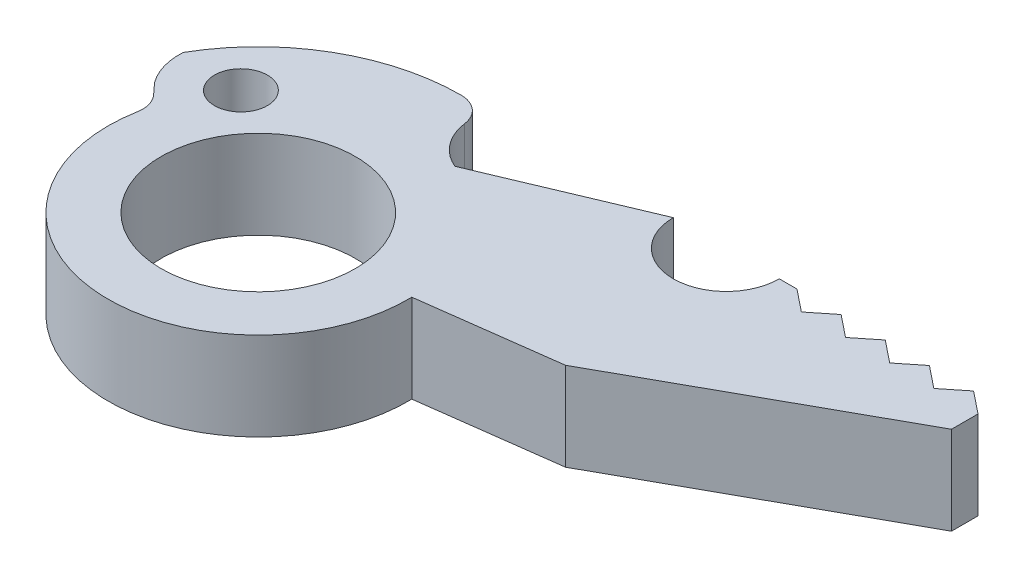
from build123d import *

# Parameters (mm, degrees)
SKETCH_1_R          = 5.5
SKETCH_1_R_2        = 1.5
EXTRUDE_2_DEPTH     = 5
CUT_EXTRUDE_1_DEPTH = 33.746182984


with BuildPart() as part:
    # Эскиз1 → Бобышка-Вытянуть2 (new body)
    with BuildSketch(Plane(origin=(0, 0, 0), x_dir=(1, 0, 0), z_dir=(0, 1, 0))):
        with BuildLine():
            ThreePointArc((-8.362025498, 1.525296552), (-0.667373394, -8.473760249), (8.497706046, 0.197463815))
            Line((8.497706046, 0.197463815), (16.18697839, 1.21124957))
            Line((16.18697839, 1.21124957), (30.25, 9))
            Line((30.25, 9), (30.25, 10.5))
            Line((30.25, 10.5), (29, 11.5))
            Line((29, 11.5), (27.75, 10.5))
            Line((27.75, 10.5), (26.5, 11.5))
            Line((26.5, 11.5), (25.25, 10.5))
            Line((25.25, 10.5), (24, 11.5))
            Line((24, 11.5), (22.75, 10.5))
            Line((22.75, 10.5), (21.5, 11.5))
            Line((21.5, 11.5), (20.25, 10.5))
            Line((20.25, 10.5), (19, 11.5))
            Line((19, 11.5), (18, 11.5))
            ThreePointArc((18, 11.5), (15, 8.5), (12, 11.5))
            Line((12, 11.5), (3.296389157, 7.834782609))
            ThreePointArc((3.296389157, 7.834782609), (2.077275401, 8.776959062), (1.486606875, 10.2))
            ThreePointArc((1.486606875, 10.2), (0.987420883, 11.129158979), (0, 11.5))
            ThreePointArc((0, 11.5), (-6.242051456, 9.658508871), (-10.485027716, 4.723790195))
            Line((-10.485027716, 4.723790195), (-8.731080367, 2.807108505))
            ThreePointArc((-8.731080367, 2.807108505), (-8.396232651, 2.209482225), (-8.362025498, 1.525296552))
        make_face()
        with Locations(Location((0, 0, 0), (0, 0, 270))):
            Circle(SKETCH_1_R, mode=Mode.SUBTRACT)
        with Locations(Location((-6.480740698, 5.5, 0), (0, 0, 270))):
            Circle(SKETCH_1_R_2, mode=Mode.SUBTRACT)
    extrude(amount=EXTRUDE_2_DEPTH)

    # Эскиз2 → Вырез-Вытянуть1 (cut, through all)
    with BuildSketch(Plane(origin=(0, 5, 0), x_dir=(1, 0, 0), z_dir=(0, 1, 0))):
        with BuildLine():
            ThreePointArc((-9.310541114, 3.440332646), (-9.842132841, 4.524785735), (-9.973477908, 5.72535924))
            ThreePointArc((-9.973477908, 5.72535924), (-10.241503709, 5.230831844), (-10.485027716, 4.723790195))
            Line((-10.485027716, 4.723790195), (-9.310541114, 3.440332646))
        make_face()
    extrude(amount=-CUT_EXTRUDE_1_DEPTH, mode=Mode.SUBTRACT)


solid = part.part
